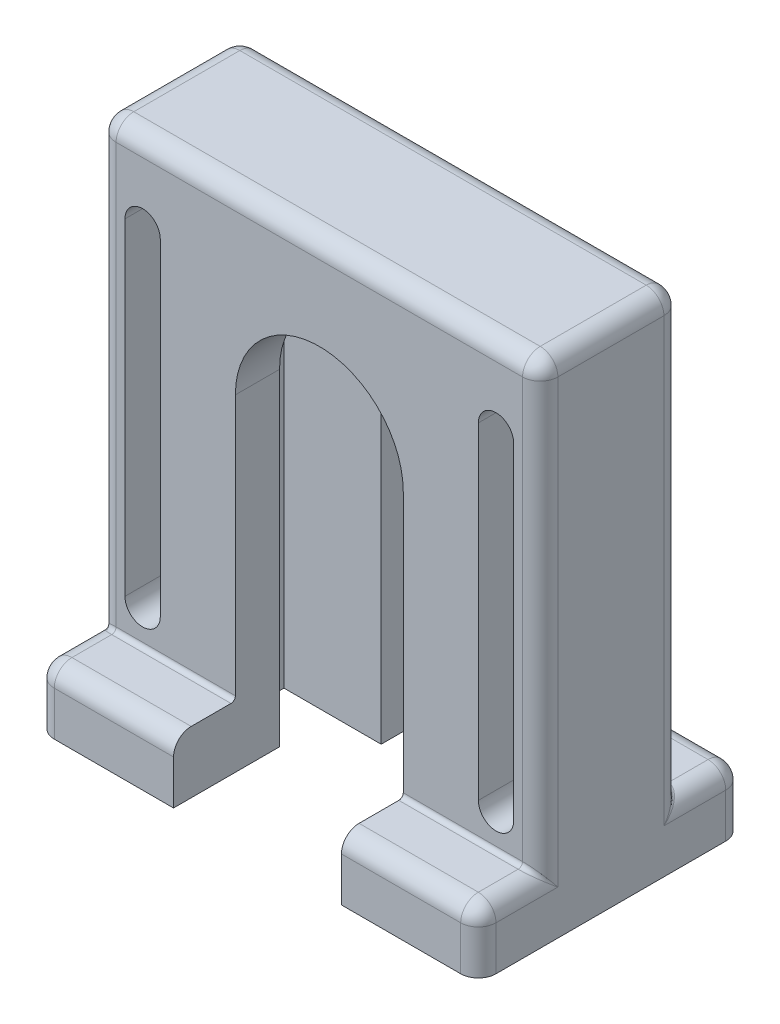
from build123d import *

# Parameters (mm, degrees)
SKETCH2_W                      = 50
SKETCH2_H                      = 30
BOSS_EXTRUDE1_DEPTH            = 7
SKETCH3_W                      = 50
SKETCH3_H                      = 16
BOSS_EXTRUDE2_DEPTH            = 50
SKETCH5_W                      = 30
SKETCH5_H                      = 6
CUT_EXTRUDE1_DEPTH             = 52
CUT_EXTRUDE3_REACH             = 68.355
CUT_EXTRUDE3_DIRECTION_2_REACH = 68.355
CUT_EXTRUDE4_REACH             = 68.355
CUT_EXTRUDE4_DIRECTION_2_REACH = 68.355
CUT_EXTRUDE5_REACH             = 68.355
FILLET1_R                      = 2
FILLET2_R                      = 0.5


with BuildPart() as part:
    # Sketch2 → Boss-Extrude1 (new body)
    with BuildSketch(Plane(origin=(0, 0, 0), x_dir=(1, 0, 0), z_dir=(0, 1, 0))):
        Rectangle(SKETCH2_W, SKETCH2_H)
    extrude(amount=BOSS_EXTRUDE1_DEPTH)

    # Sketch3 → Boss-Extrude2 (add)
    with BuildSketch(Plane(origin=(0, 7, 0), x_dir=(1, 0, 0), z_dir=(0, 1, 0))):
        Rectangle(SKETCH3_W, SKETCH3_H)
    extrude(amount=BOSS_EXTRUDE2_DEPTH)

    # Sketch5 → Cut-Extrude1 (cut)
    with BuildSketch(Plane.XZ):
        Rectangle(SKETCH5_W, SKETCH5_H)
    extrude(amount=-CUT_EXTRUDE1_DEPTH, mode=Mode.SUBTRACT)

    # Sketch4 → Cut-Extrude3 (cut, up to next)
    with BuildSketch(Plane.XY.offset(8), mode=Mode.PRIVATE) as cut_extrude3_sk1:
        with BuildLine():
            Line((-9.5, 15), (-9.5, 37))
            ThreePointArc((-9.5, 37), (0, 46.5), (9.5, 37))
            Line((9.5, 37), (9.5, 15))
            Line((9.5, 15), (9.5, 0))
            Line((9.5, 0), (-9.5, 0))
            Line((-9.5, 0), (-9.5, 15))
        make_face()
    cut_extrude3_tool1 = extrude(cut_extrude3_sk1.sketch, amount=-CUT_EXTRUDE3_REACH, mode=Mode.PRIVATE) & part.part
    add(cut_extrude3_tool1.solids().sort_by_distance((0, 22.281201, 8))[0], mode=Mode.SUBTRACT)

    # Sketch4 → Cut-Extrude3 direction 2 (cut, up to next)
    with BuildSketch(Plane.XY.offset(8), mode=Mode.PRIVATE) as cut_extrude3_direction_2_sk1:
        with BuildLine():
            Line((-9.5, 15), (-9.5, 37))
            ThreePointArc((-9.5, 37), (0, 46.5), (9.5, 37))
            Line((9.5, 37), (9.5, 15))
            Line((9.5, 15), (9.5, 0))
            Line((9.5, 0), (-9.5, 0))
            Line((-9.5, 0), (-9.5, 15))
        make_face()
    cut_extrude3_direction_2_tool1 = extrude(cut_extrude3_direction_2_sk1.sketch, amount=CUT_EXTRUDE3_DIRECTION_2_REACH, mode=Mode.PRIVATE) & part.part
    add(cut_extrude3_direction_2_tool1.solids().sort_by_distance((0, 22.281201, 8))[0], mode=Mode.SUBTRACT)

    # Sketch6 → Cut-Extrude4 (cut, up to next)
    with BuildSketch(Plane(origin=(0, 0, -8), x_dir=(-1, 0, 0), z_dir=(0, 0, -1)), mode=Mode.PRIVATE) as cut_extrude4_sk1:
        with BuildLine():
            Line((-4, 37), (-4, 0))
            Line((-4, 0), (4, 0))
            Line((4, 0), (4, 37))
            ThreePointArc((4, 37), (0, 41), (-4, 37))
        make_face()
    cut_extrude4_tool1 = extrude(cut_extrude4_sk1.sketch, amount=-CUT_EXTRUDE4_REACH, mode=Mode.PRIVATE) & part.part
    add(cut_extrude4_tool1.solids().sort_by_distance((0, 20.080724, -8))[0], mode=Mode.SUBTRACT)

    # Sketch6 → Cut-Extrude4 direction 2 (cut, up to next)
    with BuildSketch(Plane(origin=(0, 0, -8), x_dir=(-1, 0, 0), z_dir=(0, 0, -1)), mode=Mode.PRIVATE) as cut_extrude4_direction_2_sk1:
        with BuildLine():
            Line((-4, 37), (-4, 0))
            Line((-4, 0), (4, 0))
            Line((4, 0), (4, 37))
            ThreePointArc((4, 37), (0, 41), (-4, 37))
        make_face()
    cut_extrude4_direction_2_tool1 = extrude(cut_extrude4_direction_2_sk1.sketch, amount=CUT_EXTRUDE4_DIRECTION_2_REACH, mode=Mode.PRIVATE) & part.part
    add(cut_extrude4_direction_2_tool1.solids().sort_by_distance((0, 20.080724, -8))[0], mode=Mode.SUBTRACT)

    # Sketch8 → Cut-Extrude5 (cut, up to next)
    with BuildSketch(Plane.XY.offset(8), mode=Mode.PRIVATE) as cut_extrude5_sk1:
        with BuildLine():
            Line((-22, 48), (-22, 11))
            ThreePointArc((-22, 11), (-20, 9), (-18, 11))
            Line((-18, 11), (-18, 48))
            ThreePointArc((-18, 48), (-20, 50), (-22, 48))
        make_face()
    cut_extrude5_tool1 = extrude(cut_extrude5_sk1.sketch, amount=-CUT_EXTRUDE5_REACH, mode=Mode.PRIVATE) & part.part
    # Sketch8 → Cut-Extrude5 (cut, up to next)
    with BuildSketch(Plane.XY.offset(8), mode=Mode.PRIVATE) as cut_extrude5_sk2:
        with BuildLine():
            Line((18, 48), (18, 11))
            ThreePointArc((18, 11), (20, 9), (22, 11))
            Line((22, 11), (22, 48))
            ThreePointArc((22, 48), (20, 50), (18, 48))
        make_face()
    cut_extrude5_tool2 = extrude(cut_extrude5_sk2.sketch, amount=-CUT_EXTRUDE5_REACH, mode=Mode.PRIVATE) & part.part
    add(cut_extrude5_tool1.solids().sort_by_distance((-20, 29.5, 8))[0], mode=Mode.SUBTRACT)
    add(cut_extrude5_tool2.solids().sort_by_distance((20, 29.5, 8))[0], mode=Mode.SUBTRACT)

    # Fillet1
    fillet1_edges = [part.edges().sort_by_distance(p)[0] for p in [
        (25, 7, 11.5),
        (14.5, 7, -15),
        (-25, 7, 11.5),
        (25, 7, -11.5),
        (25, 32, -8),
        (-25, 32, -8),
        (-25, 32, 8),
        (25, 32, 8),
        (0, 57, -8),
        (-25, 57, 0),
        (0, 57, 8),
        (25, 57, 0),
        (-25, 7, -11.5),
        (17.25, 7, 15),
        (-14.5, 7, -15),
        (-17.25, 7, 15),
        (-25, 3.5, -15),
        (25, 3.5, -15),
        (25, 3.5, 15),
        (-25, 3.5, 15),
    ]]
    fillet(fillet1_edges, radius=FILLET1_R)

    # Fillet2
    fillet2_edges = [part.edges().sort_by_distance(p)[0] for p in [
        (-16.25, 7, 8),
        (13.5, 7, -8),
        (-24.526592034, 6.292097815, 7.292097815),
        (-24.526592034, 6.292097815, -7.292097815),
        (24.526592034, 6.292097815, 7.292097815),
        (24.526592034, 6.292097815, -7.292097815),
        (16.25, 7, 8),
        (-13.5, 7, -8),
    ]]
    fillet(fillet2_edges, radius=FILLET2_R)


solid = part.part
